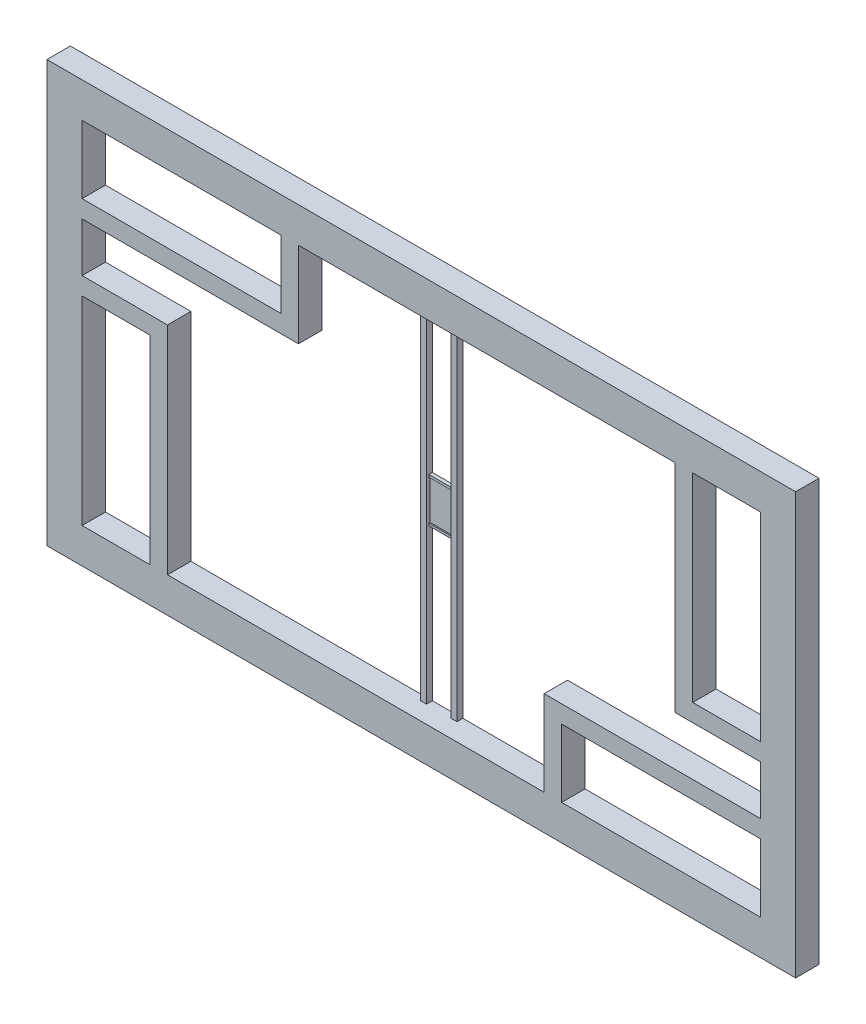
from build123d import *

# Parameters (mm, degrees)
ESBO_O1_W                = 640
ESBO_O1_H                = 360
ESBO_O1_W_2              = 170
ESBO_O1_H_2              = 58
ESBO_O1_W_3              = 58
ESBO_O1_H_3              = 170
RESSALTO_EXTRUS_O1_DEPTH = 20
SKETCH1_W                = 5
SKETCH1_H                = 5
BOSS_EXTRUDE1_DEPTH      = 300
SKETCH2_W                = 2
SKETCH2_H                = 34
BOSS_EXTRUDE2_DEPTH      = 21
SKETCH3_W                = 3
SKETCH3_H                = 2
BOSS_EXTRUDE3_DEPTH      = 21


with BuildPart() as part:
    # Esboço1 → Ressalto-extrusão1 (new body)
    with BuildSketch(Plane.XY):
        with Locations((320, 180)):
            Rectangle(ESBO_O1_W, ESBO_O1_H)
        Polygon((215, 330), (537, 330), (537, 160), (537, 145), (610, 145), (610, 103), (425, 103), (425, 88), (425, 30), (103, 30), (103, 215), (88, 215), (30, 215), (30, 257), (200, 257), (215, 257), align=None, mode=Mode.SUBTRACT)
        with Locations((115, 301)):
            Rectangle(ESBO_O1_W_2, ESBO_O1_H_2, mode=Mode.SUBTRACT)
        with Locations((59, 115)):
            Rectangle(ESBO_O1_W_3, ESBO_O1_H_3, mode=Mode.SUBTRACT)
        with Locations((581, 245)):
            Rectangle(ESBO_O1_W_3, ESBO_O1_H_3, mode=Mode.SUBTRACT)
        with Locations((525, 59)):
            Rectangle(ESBO_O1_W_2, ESBO_O1_H_2, mode=Mode.SUBTRACT)
    extrude(amount=RESSALTO_EXTRUS_O1_DEPTH)

    # Sketch1 → Boss-Extrude1 (add)
    with BuildSketch(Plane.XZ.offset(-330)):
        with Locations((307, 2.5)):
            Rectangle(SKETCH1_W, SKETCH1_H)
        with Locations((333, 2.5)):
            Rectangle(SKETCH1_W, SKETCH1_H)
    extrude(amount=BOSS_EXTRUDE1_DEPTH)

    # Sketch2 → Boss-Extrude2 (add)
    with BuildSketch(Plane(origin=(309.5, 0, 0), x_dir=(0, 0, -1), z_dir=(1, 0, 0))):
        with Locations((-1, 180)):
            Rectangle(SKETCH2_W, SKETCH2_H)
    extrude(amount=BOSS_EXTRUDE2_DEPTH)

    # Sketch3 → Boss-Extrude3 (add)
    with BuildSketch(Plane(origin=(309.5, 0, 0), x_dir=(0, 0, -1), z_dir=(1, 0, 0))):
        with Locations((-1.5, 198)):
            Rectangle(SKETCH3_W, SKETCH3_H)
        with Locations((-1.5, 162)):
            Rectangle(SKETCH3_W, SKETCH3_H)
    extrude(amount=BOSS_EXTRUDE3_DEPTH)


solid = part.part
